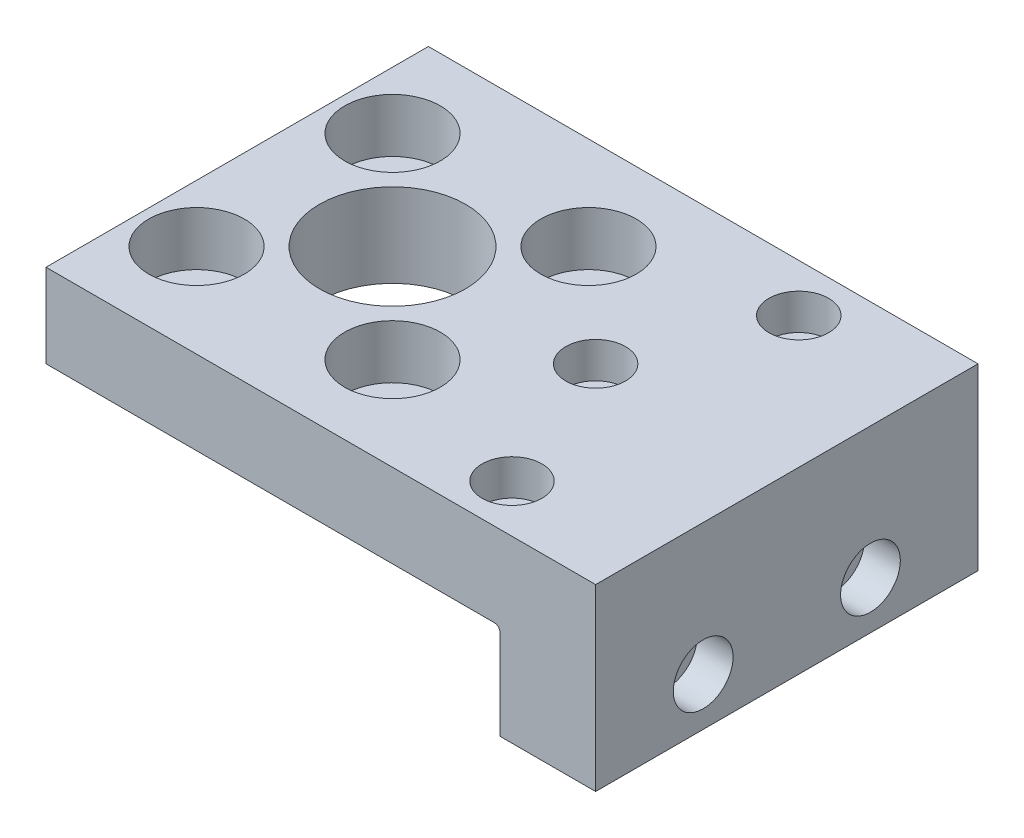
from build123d import *

# Parameters (mm, degrees)
SKETCH1_W           = 146.05
SKETCH1_H           = 101.6
BOSS_EXTRUDE1_DEPTH = 11.1125
BOSS_EXTRUDE2_START = -36.5125
SKETCH2_W           = 25.4
SKETCH2_H           = 101.6
BOSS_EXTRUDE2_DEPTH = 25.4
FILLET1_R           = 1.524
CUT_EXTRUDE2_START  = 11.1125
SKETCH3_R           = 19.4437
CUT_EXTRUDE2_DEPTH  = 36.5125
CUT_EXTRUDE4_START  = 11.1125
SKETCH4_R           = 6.7437
CUT_EXTRUDE4_DEPTH  = 108.270980028
CUT_EXTRUDE6_START  = 11.1125
SKETCH5_R           = 12.7
CUT_EXTRUDE6_DEPTH  = 14.2875
CUT_EXTRUDE8_START  = 11.1125
SKETCH6_R           = 5.1562
CUT_EXTRUDE8_DEPTH  = 108.270980028
CUT_EXTRUDE10_START = 11.1125
SKETCH7_R           = 7.9375
CUT_EXTRUDE10_DEPTH = 9.525
CUT_EXTRUDE12_START = 11.1125
SKETCH8_R           = 5.1562
CUT_EXTRUDE12_DEPTH = 108.270980028
CUT_EXTRUDE14_START = 11.1125
SKETCH9_R           = 7.9375
CUT_EXTRUDE14_DEPTH = 9.525
CUT_EXTRUDE16_START = 73.025
SKETCH10_R          = 5.1562
CUT_EXTRUDE16_DEPTH = 170.183480028
CUT_EXTRUDE18_START = 73.025
SKETCH11_R          = 7.9375
CUT_EXTRUDE18_DEPTH = 9.525


with BuildPart() as part:
    # Sketch1 → Boss-Extrude1 (new, symmetric)
    with BuildSketch(Plane(origin=(0, 0, 0), x_dir=(1, 0, 0), z_dir=(0, 1, 0))):
        Rectangle(SKETCH1_W, SKETCH1_H)
    extrude(amount=BOSS_EXTRUDE1_DEPTH, both=True)

    # Sketch2 → Boss-Extrude2 (add)
    with BuildSketch(Plane(origin=(0, 0, 0), x_dir=(1, 0, 0), z_dir=(0, 1, 0)).offset(BOSS_EXTRUDE2_START)):
        with Locations((60.325, 0)):
            Rectangle(SKETCH2_W, SKETCH2_H)
    extrude(amount=BOSS_EXTRUDE2_DEPTH)

    # Fillet1
    fillet1_edges = [part.edges().sort_by_distance(p)[0] for p in [
        (47.625, -11.1125, 0),
    ]]
    fillet(fillet1_edges, radius=FILLET1_R)

    # Sketch3 → Cut-Extrude2 (cut)
    with BuildSketch(Plane(origin=(0, 0, 0), x_dir=(1, 0, 0), z_dir=(0, 1, 0)).offset(CUT_EXTRUDE2_START)):
        with Locations(Location((-31.75, 0, 0), (0, 0, 270))):
            Circle(SKETCH3_R)
    extrude(amount=-CUT_EXTRUDE2_DEPTH, mode=Mode.SUBTRACT)

    # Sketch4 → Cut-Extrude4 (cut, through all)
    with BuildSketch(Plane(origin=(0, 0, 0), x_dir=(1, 0, 0), z_dir=(0, 1, 0)).offset(CUT_EXTRUDE4_START)):
        with Locations(Location((-57.785, -26.035, 0), (0, 0, 270))):
            Circle(SKETCH4_R)
        with Locations(Location((-5.715, -26.035, 0), (0, 0, 270))):
            Circle(SKETCH4_R)
        with Locations(Location((-57.785, 26.035, 0), (0, 0, 270))):
            Circle(SKETCH4_R)
        with Locations(Location((-5.715, 26.035, 0), (0, 0, 270))):
            Circle(SKETCH4_R)
    extrude(amount=-CUT_EXTRUDE4_DEPTH, mode=Mode.SUBTRACT)

    # Sketch5 → Cut-Extrude6 (cut)
    with BuildSketch(Plane(origin=(0, 0, 0), x_dir=(1, 0, 0), z_dir=(0, 1, 0)).offset(CUT_EXTRUDE6_START)):
        with Locations(Location((-57.785, -26.035, 0), (0, 0, 270))):
            Circle(SKETCH5_R)
        with Locations(Location((-5.715, -26.035, 0), (0, 0, 270))):
            Circle(SKETCH5_R)
        with Locations(Location((-57.785, 26.035, 0), (0, 0, 270))):
            Circle(SKETCH5_R)
        with Locations(Location((-5.715, 26.035, 0), (0, 0, 270))):
            Circle(SKETCH5_R)
    extrude(amount=-CUT_EXTRUDE6_DEPTH, mode=Mode.SUBTRACT)

    # Sketch6 → Cut-Extrude8 (cut, through all)
    with BuildSketch(Plane(origin=(0, 0, 0), x_dir=(1, 0, 0), z_dir=(0, 1, 0)).offset(CUT_EXTRUDE8_START)):
        with Locations(Location((38.1, -38.1, 0), (0, 0, 270))):
            Circle(SKETCH6_R)
        with Locations(Location((38.1, 38.1, 0), (0, 0, 270))):
            Circle(SKETCH6_R)
    extrude(amount=-CUT_EXTRUDE8_DEPTH, mode=Mode.SUBTRACT)

    # Sketch7 → Cut-Extrude10 (cut)
    with BuildSketch(Plane(origin=(0, 0, 0), x_dir=(1, 0, 0), z_dir=(0, 1, 0)).offset(CUT_EXTRUDE10_START)):
        with Locations(Location((38.1, -38.1, 0), (0, 0, 270))):
            Circle(SKETCH7_R)
        with Locations(Location((38.1, 38.1, 0), (0, 0, 270))):
            Circle(SKETCH7_R)
    extrude(amount=-CUT_EXTRUDE10_DEPTH, mode=Mode.SUBTRACT)

    # Sketch8 → Cut-Extrude12 (cut, through all)
    with BuildSketch(Plane(origin=(0, 0, 0), x_dir=(1, 0, 0), z_dir=(0, 1, 0)).offset(CUT_EXTRUDE12_START)):
        with Locations(Location((22.225, 0, 0), (0, 0, 270))):
            Circle(SKETCH8_R)
    extrude(amount=-CUT_EXTRUDE12_DEPTH, mode=Mode.SUBTRACT)

    # Sketch9 → Cut-Extrude14 (cut)
    with BuildSketch(Plane(origin=(0, 0, 0), x_dir=(1, 0, 0), z_dir=(0, 1, 0)).offset(CUT_EXTRUDE14_START)):
        with Locations(Location((22.225, 0, 0), (0, 0, 270))):
            Circle(SKETCH9_R)
    extrude(amount=-CUT_EXTRUDE14_DEPTH, mode=Mode.SUBTRACT)

    # Sketch10 → Cut-Extrude16 (cut, through all)
    with BuildSketch(Plane(origin=(0, 0, 0), x_dir=(0, 0, -1), z_dir=(1, 0, 0)).offset(CUT_EXTRUDE16_START)):
        with Locations((-22.225, -23.8125)):
            Circle(SKETCH10_R)
        with Locations((22.225, -23.8125)):
            Circle(SKETCH10_R)
    extrude(amount=-CUT_EXTRUDE16_DEPTH, mode=Mode.SUBTRACT)

    # Sketch11 → Cut-Extrude18 (cut)
    with BuildSketch(Plane(origin=(0, 0, 0), x_dir=(0, 0, -1), z_dir=(1, 0, 0)).offset(CUT_EXTRUDE18_START)):
        with Locations((-22.225, -23.8125)):
            Circle(SKETCH11_R)
        with Locations((22.225, -23.8125)):
            Circle(SKETCH11_R)
    extrude(amount=-CUT_EXTRUDE18_DEPTH, mode=Mode.SUBTRACT)


solid = part.part
